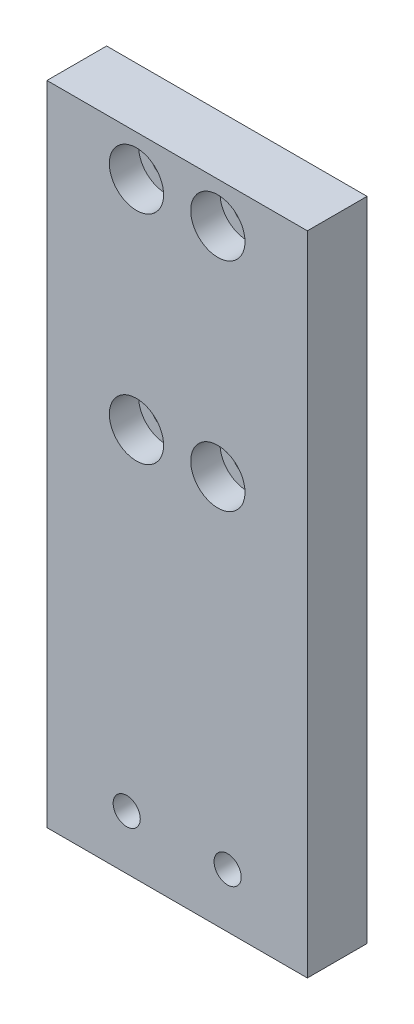
from build123d import *

# Parameters (mm, degrees)
SKETCH_1_W                   = 48
SKETCH_1_H                   = 55
EXTRUDE_1_DEPTH              = 5.5
HOLE_WIZARD_M5_1_D           = 5.5
HOLE_WIZARD_M5_1_CBORE_D     = 10
HOLE_WIZARD_M5_1_CBORE_DEPTH = 5.4
MIRROR_2_COPY_1_D            = 5.5
MIRROR_2_COPY_1_CBORE_D      = 10
MIRROR_2_COPY_1_CBORE_DEPTH  = 5.4
SKETCH_4_W                   = 48
SKETCH_4_H                   = 11
EXTRUDE_2_DEPTH              = 64.277224085
SKETCH_5_R                   = 2.5
CUT_EXTRUDE_1_DEPTH          = 96.498999266


with BuildPart() as part:
    # 草图1 → 凸台-拉伸1 (new, symmetric)
    with BuildSketch(Plane.XY):
        Rectangle(SKETCH_1_W, SKETCH_1_H)
    extrude(amount=EXTRUDE_1_DEPTH, both=True)

    # M5 六角凹头螺钉的柱形沉头孔1 (through all)
    with Locations(Plane(origin=(-7.5, -20, 5.5), x_dir=(1, 0, 0), z_dir=(0, 0, 1))):
        with Locations((0, 0)):
            hole_wizard_m5_1 = CounterBoreHole(HOLE_WIZARD_M5_1_D / 2, HOLE_WIZARD_M5_1_CBORE_D / 2, HOLE_WIZARD_M5_1_CBORE_DEPTH)

    # 镜向1: M5 六角凹头螺钉的柱形沉头孔1 across plane
    add(hole_wizard_m5_1.mirror(Plane(origin=(0, 0, 0), x_dir=(0, 0, 1), z_dir=(1, 0, 0))), mode=Mode.SUBTRACT)

    # 镜向2: M5 六角凹头螺钉的柱形沉头孔1 across plane
    add(hole_wizard_m5_1.mirror(Plane.ZX), mode=Mode.SUBTRACT)

    # 镜向2 copy 1 (through all)
    with Locations(Plane(origin=(7.5, 20, 5.5), x_dir=(-1, 0, 0), z_dir=(0, 0, 1))):
        with Locations((0, 0)):
            CounterBoreHole(MIRROR_2_COPY_1_D / 2, MIRROR_2_COPY_1_CBORE_D / 2, MIRROR_2_COPY_1_CBORE_DEPTH)

    # 草图4 → 凸台-拉伸2 (add)
    with BuildSketch(Plane.XZ.offset(27.5)):
        Rectangle(SKETCH_4_W, SKETCH_4_H)
    extrude(amount=EXTRUDE_2_DEPTH)

    # 草图5 → 切除-拉伸1 (cut, through all)
    with BuildSketch(Plane.XY.offset(5.5)):
        with Locations((-9.3, -81.777224085)):
            Circle(SKETCH_5_R)
        with Locations((9.3, -81.777224085)):
            Circle(SKETCH_5_R)
    extrude(amount=-CUT_EXTRUDE_1_DEPTH, mode=Mode.SUBTRACT)


solid = part.part
